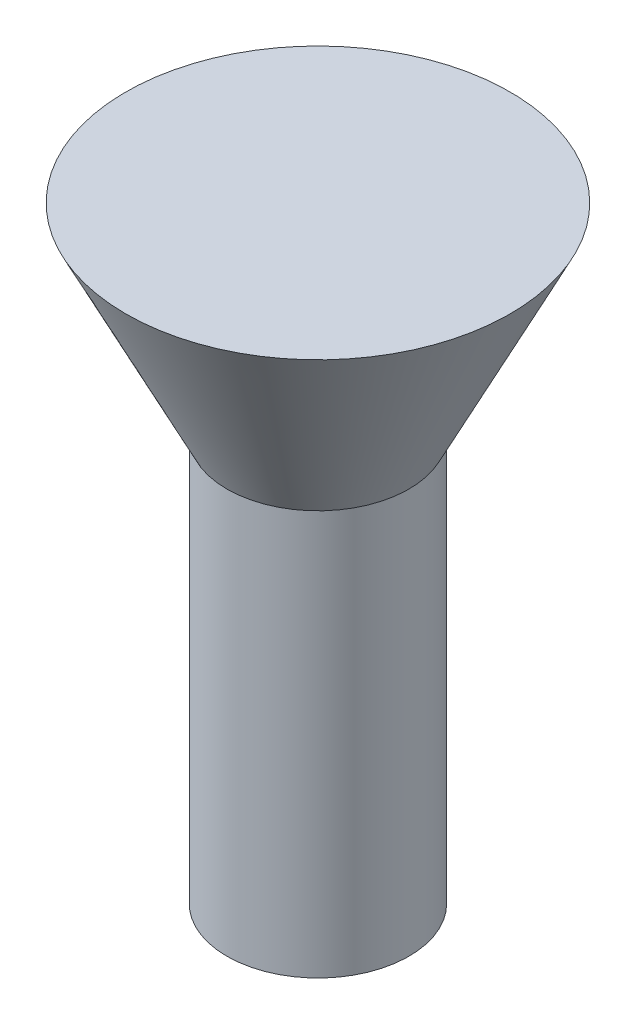
from build123d import *

# Parameters (mm, degrees)
CROQUIS1_R              = 4.5
SALIENTE_EXTRUIR1_DEPTH = 20
CROQUIS2_R              = 9.5


with BuildPart() as part:
    # Croquis1 → Saliente-Extruir1 (new body)
    with BuildSketch(Plane(origin=(0, 0, 0), x_dir=(1, 0, 0), z_dir=(0, 1, 0))):
        with Locations(Location((0, 0, 0), (0, 0, 270))):
            Circle(CROQUIS1_R)
    extrude(amount=SALIENTE_EXTRUIR1_DEPTH)

    # Croquis2 → section 0 of recubrir1
    with BuildSketch(Plane(origin=(0, 30, 0), x_dir=(1, 0, 0), z_dir=(0, 1, 0)), mode=Mode.PRIVATE) as recubrir1_s0:
        Circle(CROQUIS2_R)
    # loft up to a face of the part (recubrir1)
    loft([recubrir1_s0.sketch, part.faces().sort_by_distance((0, 20, 0))[0]])


solid = part.part
